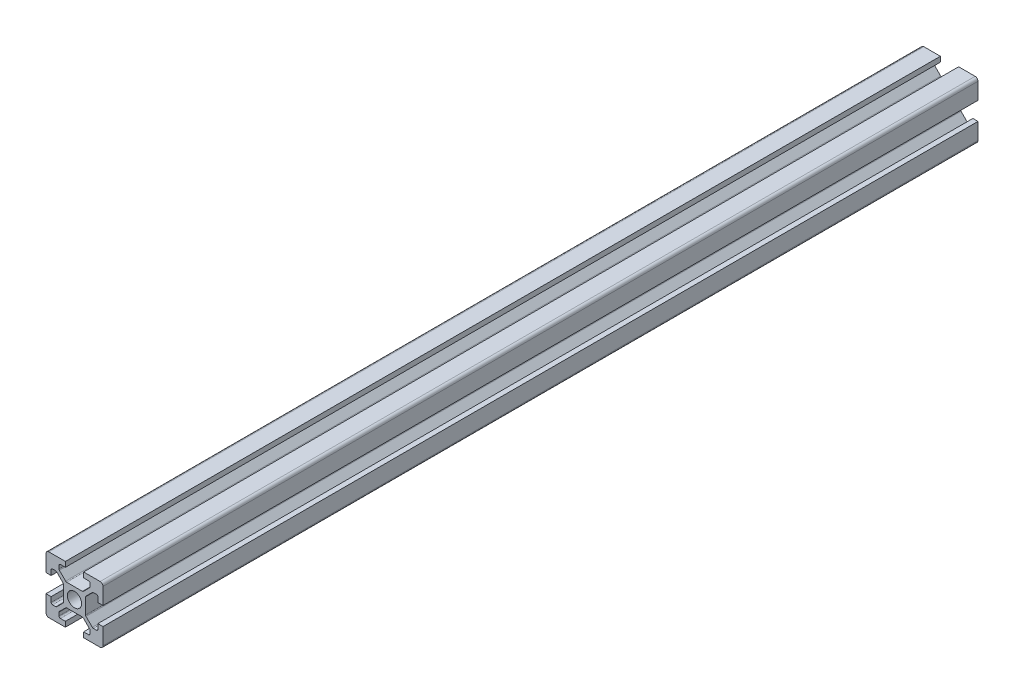
from build123d import *

# Parameters (mm, degrees)
SKETCH1_R           = 2.5
BOSS_EXTRUDE1_DEPTH = 307
FILLET1_R           = 1
FILLET2_R           = 0.5
FILLET3_R           = 0.5
FILLET4_R           = 0.5
FILLET5_R           = 0.5


with BuildPart() as part:
    # Sketch1 → Boss-Extrude1 (new body)
    with BuildSketch(Plane.XY):
        Polygon((13.2, 0), (13.2, 1.8), (15.45, 1.8), (15.45, 3.6), (12.95, 6.1), (7.05, 6.1), (4.55, 3.6), (4.55, 1.8), (6.8, 1.8), (6.8, 0), (0, 0), (0, 6.8), (1.8, 6.8), (1.8, 4.55), (3.6, 4.55), (6.1, 7.05), (6.1, 12.95), (3.6, 15.45), (1.8, 15.45), (1.8, 13.2), (0, 13.2), (0, 20), (6.8, 20), (6.8, 18.2), (4.55, 18.2), (4.55, 16.4), (7.05, 13.9), (12.95, 13.9), (15.45, 16.4), (15.45, 18.2), (13.2, 18.2), (13.2, 20), (20, 20), (20, 13.2), (18.2, 13.2), (18.2, 15.45), (16.4, 15.45), (13.9, 12.95), (13.9, 7.05), (16.4, 4.55), (18.2, 4.55), (18.2, 6.8), (20, 6.8), (20, 0), align=None)
        with Locations((10, 10)):
            Circle(SKETCH1_R, mode=Mode.SUBTRACT)
    extrude(amount=BOSS_EXTRUDE1_DEPTH)

    # Fillet1
    fillet1_edges = [part.edges().sort_by_distance(p)[0] for p in [
        (0, 0, 153.5),
        (0, 20, 153.5),
        (20, 20, 153.5),
        (20, 0, 153.5),
    ]]
    fillet(fillet1_edges, radius=FILLET1_R)

    # Fillet2
    fillet2_edges = [part.edges().sort_by_distance(p)[0] for p in [
        (4.55, 18.2, 153.5),
        (4.55, 16.4, 153.5),
        (7.05, 13.9, 153.5),
        (12.95, 13.9, 153.5),
        (15.45, 16.4, 153.5),
        (15.45, 18.2, 153.5),
    ]]
    fillet(fillet2_edges, radius=FILLET2_R)

    # Fillet3
    fillet3_edges = [part.edges().sort_by_distance(p)[0] for p in [
        (18.2, 15.45, 153.5),
        (16.4, 15.45, 153.5),
        (13.9, 12.95, 153.5),
        (13.9, 7.05, 153.5),
        (16.4, 4.55, 153.5),
        (18.2, 4.55, 153.5),
    ]]
    fillet(fillet3_edges, radius=FILLET3_R)

    # Fillet4
    fillet4_edges = [part.edges().sort_by_distance(p)[0] for p in [
        (1.8, 4.55, 153.5),
        (3.6, 4.55, 153.5),
        (6.1, 7.05, 153.5),
        (6.1, 12.95, 153.5),
        (3.6, 15.45, 153.5),
        (1.8, 15.45, 153.5),
    ]]
    fillet(fillet4_edges, radius=FILLET4_R)

    # Fillet5
    fillet5_edges = [part.edges().sort_by_distance(p)[0] for p in [
        (15.45, 1.8, 153.5),
        (15.45, 3.6, 153.5),
        (12.95, 6.1, 153.5),
        (7.05, 6.1, 153.5),
        (4.55, 3.6, 153.5),
        (4.55, 1.8, 153.5),
    ]]
    fillet(fillet5_edges, radius=FILLET5_R)


solid = part.part
